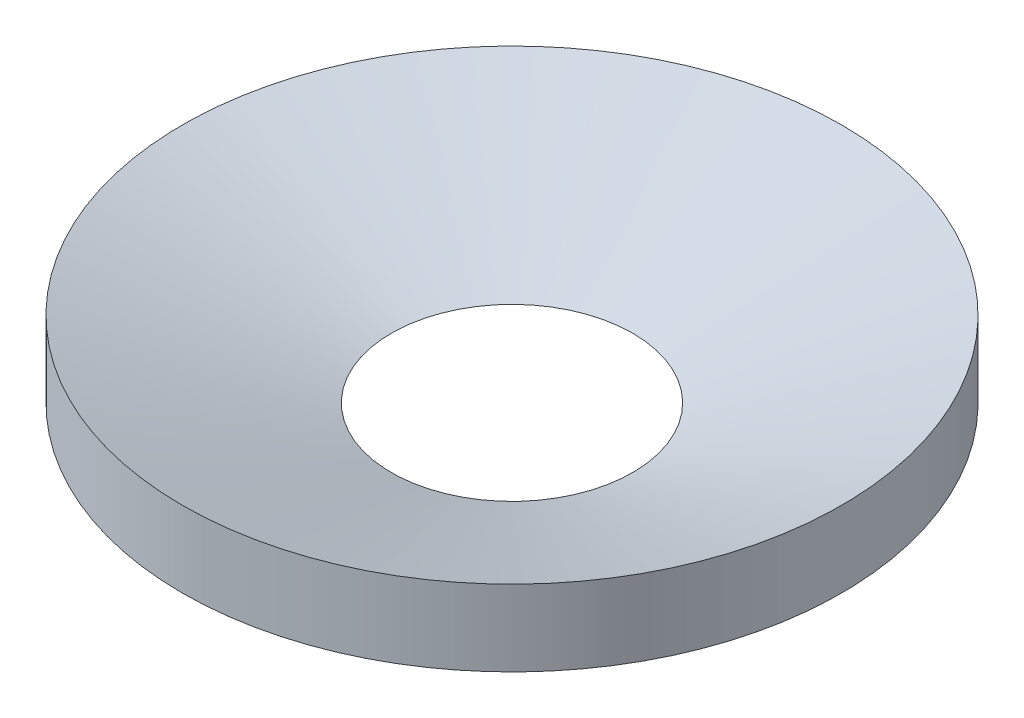
from build123d import *


with BuildPart() as part:
    # Schizzo1 → Rivoluzione1 (revolve)
    with BuildSketch(Plane.XY, mode=Mode.PRIVATE) as rivoluzione1_sk:
        Polygon((-71, 16.378660542), (-71, 0), (-26, 0), align=None)
    revolve(rivoluzione1_sk.sketch.rotate(Axis((0, 0, 0), (0, 1, 0)), 270), axis=Axis((0, 0, 0), (0, 1, 0)))


solid = part.part
